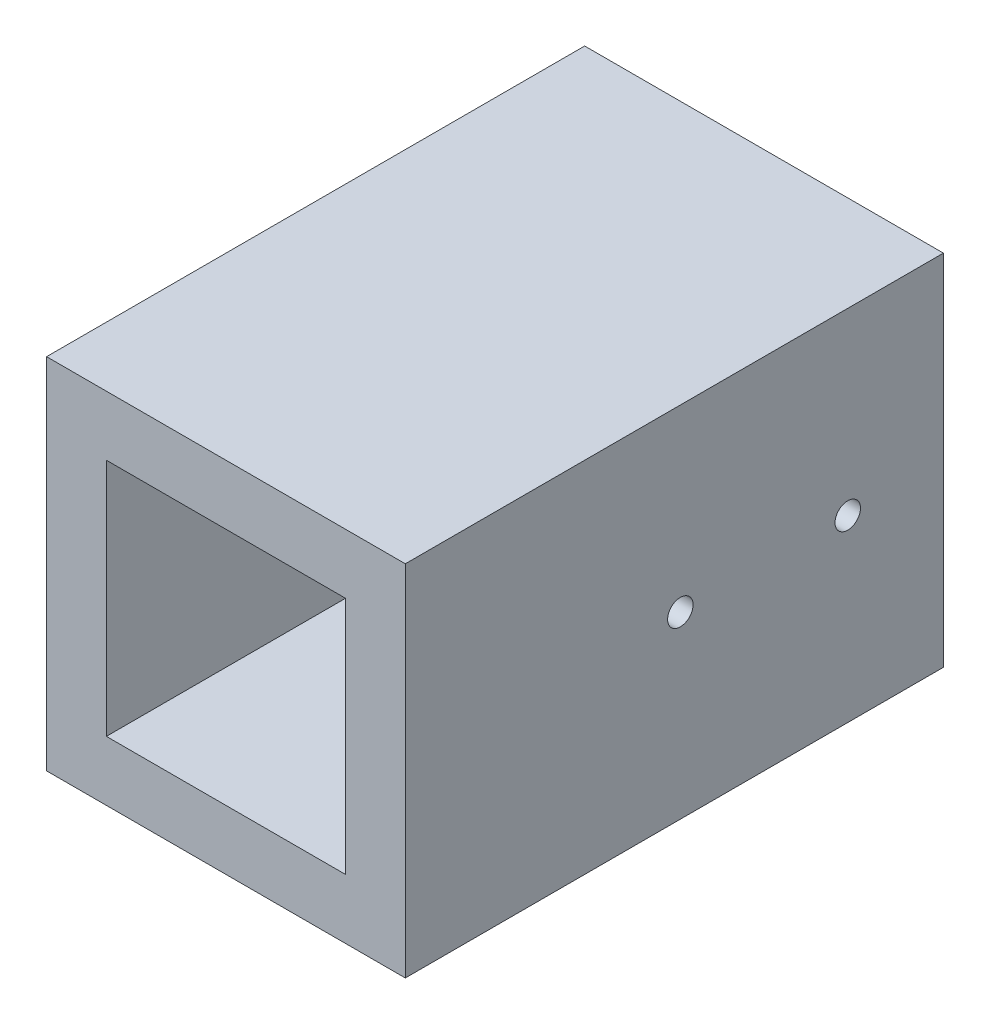
from build123d import *

# Parameters (mm, degrees)
BOSS_EXTRUDE1_DEPTH       = 76.2
BOSS_EXTRUDE1_DEPTH_BACK  = 76.2
SKETCH3_W                 = 38.1
SKETCH3_H                 = 38.1
SKETCH3_W_2               = 25.4
SKETCH3_H_2               = 25.4
SKETCH4_W                 = 38.1
SKETCH4_H                 = 38.1
SKETCH4_W_2               = 25.4
SKETCH4_H_2               = 25.4
CUT_EXTRUDE1_DEPTH        = 95.25
CUT_EXTRUDE4_REACH        = 89.298
SKETCH7_R                 = 3.81
F_6_32_TAPPED_HOLE1_D     = 2.7051
F_6_32_TAPPED_HOLE1_DEPTH = 6.35


with BuildPart() as part:
    # Sketch3 → Boss-Extrude1 (new, two sides: drawn at the far end of the back side and taken through both)
    with BuildSketch(Plane.XY.offset(-BOSS_EXTRUDE1_DEPTH_BACK)):
        Rectangle(SKETCH3_W, SKETCH3_H)
        Rectangle(SKETCH3_W_2, SKETCH3_H_2, mode=Mode.SUBTRACT)
    extrude(amount=BOSS_EXTRUDE1_DEPTH + BOSS_EXTRUDE1_DEPTH_BACK)

    # Sketch4 → Cut-Extrude1 (cut)
    with BuildSketch(Plane(origin=(0, 0, -76.2), x_dir=(-1, 0, 0), z_dir=(0, 0, -1))):
        Rectangle(SKETCH4_W, SKETCH4_H)
        Rectangle(SKETCH4_W_2, SKETCH4_H_2, mode=Mode.SUBTRACT)
    extrude(amount=-CUT_EXTRUDE1_DEPTH, mode=Mode.SUBTRACT)

    # Sketch7 → Cut-Extrude4 (cut, up to next)
    with BuildSketch(Plane(origin=(-19.05, 0, 0), x_dir=(0, -1, 0), z_dir=(-1, 0, 0)), mode=Mode.PRIVATE) as cut_extrude4_sk1:
        with Locations(Location((0, 39.37, 0), (0, 0, 90))):
            Circle(SKETCH7_R)
    cut_extrude4_tool1 = extrude(cut_extrude4_sk1.sketch, amount=-CUT_EXTRUDE4_REACH, mode=Mode.PRIVATE) & part.part
    add(cut_extrude4_tool1.solids().sort_by_distance((-19.05, 0, 39.37))[0], mode=Mode.SUBTRACT)

    # #6-32 Tapped Hole1
    with Locations(Plane(origin=(19.05, 0, 0), x_dir=(0, 0, -1), z_dir=(1, 0, 0))):
        with Locations((-29.21, 0), (-46.99, 0)):
            Hole(F_6_32_TAPPED_HOLE1_D / 2, depth=F_6_32_TAPPED_HOLE1_DEPTH)


solid = part.part
